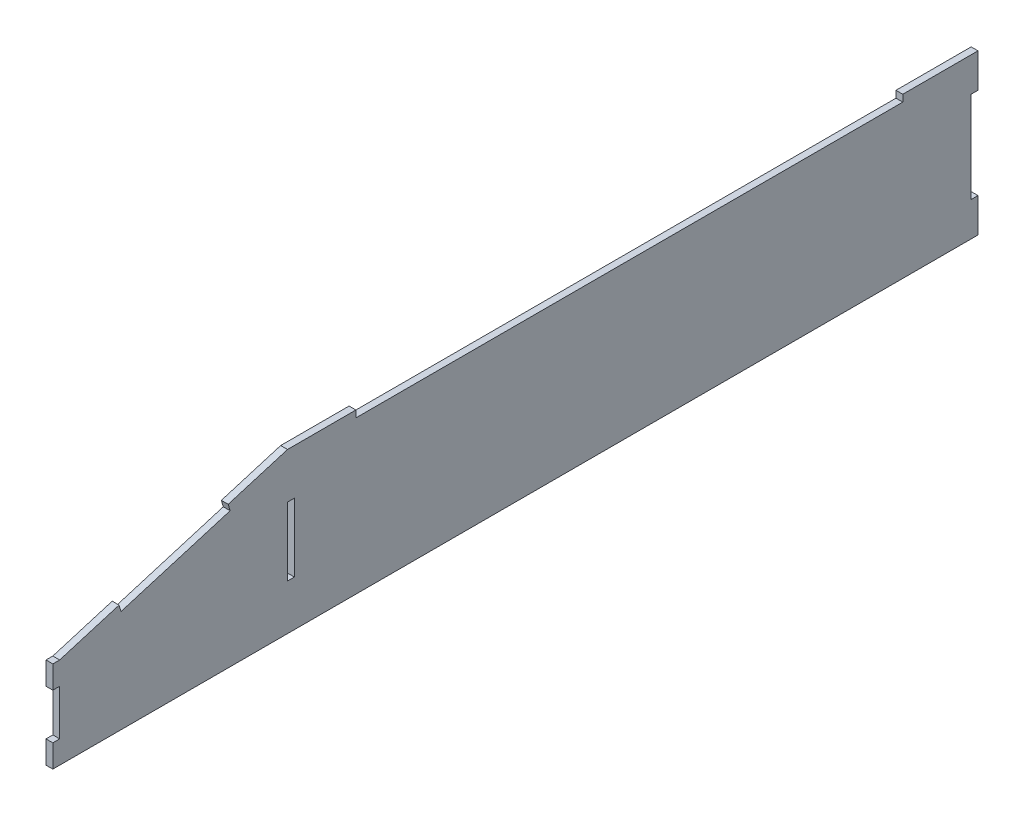
from build123d import *

# Parameters (mm, degrees)
BOSS_EXTRUDE1_DEPTH      = 3
CUT_EXTRUDE2_DEPTH       = 295.638673234
CUT_EXTRUDE2_DEPTH_BACK  = 3
CUT_EXTRUDE6_DEPTH       = 295.638673234
CUT_EXTRUDE6_DEPTH_BACK  = 3
CUT_EXTRUDE11_DEPTH      = 295.638673234
CUT_EXTRUDE11_DEPTH_BACK = 3
CUT_EXTRUDE12_DEPTH      = 295.638673234
CUT_EXTRUDE12_DEPTH_BACK = 3
SKETCH9_W                = 3
SKETCH9_H                = 30
CUT_EXTRUDE13_DEPTH      = 3


with BuildPart() as part:
    # Sketch1 → Boss-Extrude1 (new body)
    with BuildSketch(Plane(origin=(0, 0, 0), x_dir=(0, 0, -1), z_dir=(1, 0, 0))):
        Polygon((286.144320394, 0.17389594), (286.144320394, 70.17389594), (-16.855679606, 70.17389594), (-116.855679606, 40.17389594), (-119.855679606, 40.17389594), (-119.855679606, 0.17389594), align=None)
    extrude(amount=BOSS_EXTRUDE1_DEPTH)

    # Sketch5 → Cut-Extrude2 (cut, two sides: drawn at the far end of the back side and taken through both)
    with BuildSketch(Plane(origin=(3, 0, 0), x_dir=(0, 0, -1), z_dir=(1, 0, 0)).offset(-CUT_EXTRUDE2_DEPTH_BACK)):
        Polygon((1115.56118622, 55.17389594), (286.144320394, 55.17389594), (283.144320394, 55.17389594), (283.144320394, 15.17389594), (286.144320394, 15.17389594), (1115.56118622, 15.17389594), (2774.394917872, 15.17389594), (2774.394917872, 55.17389594), align=None)
    extrude(amount=CUT_EXTRUDE2_DEPTH + CUT_EXTRUDE2_DEPTH_BACK, mode=Mode.SUBTRACT)

    # Sketch6 → Cut-Extrude6 (cut, two sides: drawn at the far end of the back side and taken through both)
    with BuildSketch(Plane(origin=(3, 0, 0), x_dir=(0, 0, -1), z_dir=(1, 0, 0)).offset(-CUT_EXTRUDE6_DEPTH_BACK)):
        Polygon((253.144320394, 839.196952243), (253.144320394, 70.17389594), (253.144320394, 67.17389594), (13.144320394, 67.17389594), (13.144320394, 70.17389594), (13.144320394, 839.196952243), (13.144320394, 2377.24306485), (253.144320394, 2377.24306485), align=None)
    extrude(amount=CUT_EXTRUDE6_DEPTH + CUT_EXTRUDE6_DEPTH_BACK, mode=Mode.SUBTRACT)

    # Sketch7 → Cut-Extrude11 (cut, two sides: drawn at the far end of the back side and taken through both)
    with BuildSketch(Plane(origin=(3, 0, 0), x_dir=(0, 0, -1), z_dir=(1, 0, 0)).offset(-CUT_EXTRUDE11_DEPTH_BACK)):
        Polygon((-264.146282978, 799.817128167), (-42.908554564, 62.358033452), (-42.046510907, 59.484554597), (-89.937825168, 45.117160318), (-90.799868825, 47.990639174), (-312.037597239, 785.449733889), (-754.513054068, 2260.367923318), (-706.621739807, 2274.735317597), align=None)
    extrude(amount=CUT_EXTRUDE11_DEPTH + CUT_EXTRUDE11_DEPTH_BACK, mode=Mode.SUBTRACT)

    # Sketch8 → Cut-Extrude12 (cut, two sides: drawn at the far end of the back side and taken through both)
    with BuildSketch(Plane(origin=(3, 0, 0), x_dir=(0, 0, -1), z_dir=(1, 0, 0)).offset(-CUT_EXTRUDE12_DEPTH_BACK)):
        Polygon((-950.674782697, 30.17389594), (-119.855679606, 30.17389594), (-116.855679606, 30.17389594), (-116.855679606, 10.17389594), (-119.855679606, 10.17389594), (-950.674782697, 10.17389594), (-2612.31298888, 10.17389594), (-2612.31298888, 30.17389594), align=None)
    extrude(amount=CUT_EXTRUDE12_DEPTH + CUT_EXTRUDE12_DEPTH_BACK, mode=Mode.SUBTRACT)

    # Sketch9 → Cut-Extrude13 (cut)
    with BuildSketch(Plane(origin=(3, 0, 0), x_dir=(0, 0, -1), z_dir=(1, 0, 0))):
        with Locations((-15.355679606, 35.17389594)):
            Rectangle(SKETCH9_W, SKETCH9_H)
    extrude(amount=-CUT_EXTRUDE13_DEPTH, mode=Mode.SUBTRACT)


solid = part.part
